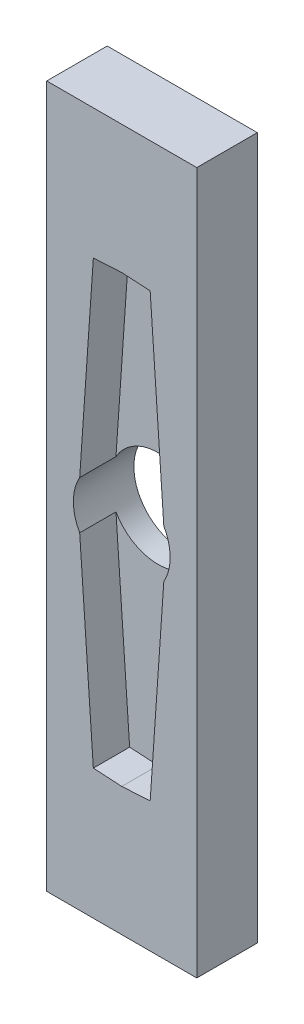
from build123d import *

# Parameters (mm, degrees)
SKETCH1_W           = 12.4
SKETCH1_H           = 58
BOSS_EXTRUDE1_DEPTH = 5
CUT_EXTRUDE1_DEPTH  = 3
SKETCH4_R           = 4
CUT_EXTRUDE2_DEPTH  = 5


with BuildPart() as part:
    # Sketch1 → Boss-Extrude1 (new body)
    with BuildSketch(Plane.XY):
        Rectangle(SKETCH1_W, SKETCH1_H)
    extrude(amount=-BOSS_EXTRUDE1_DEPTH)

    # Sketch2 → Cut-Extrude1 (cut)
    with BuildSketch(Plane.XY):
        Polygon((-3.613807992, 0), (-2.3482015, 18.253803872), (0, 18.387804485), (2.3482015, 18.253803872), (3.613807992, 0), (2.3482015, -18.253803872), (0, -18.387804485), (-2.3482015, -18.253803872), align=None)
    extrude(amount=-CUT_EXTRUDE1_DEPTH, mode=Mode.SUBTRACT)

    # Sketch4 → Cut-Extrude2 (cut)
    with BuildSketch(Plane.XY):
        Circle(SKETCH4_R)
    extrude(amount=-CUT_EXTRUDE2_DEPTH, mode=Mode.SUBTRACT)


solid = part.part
